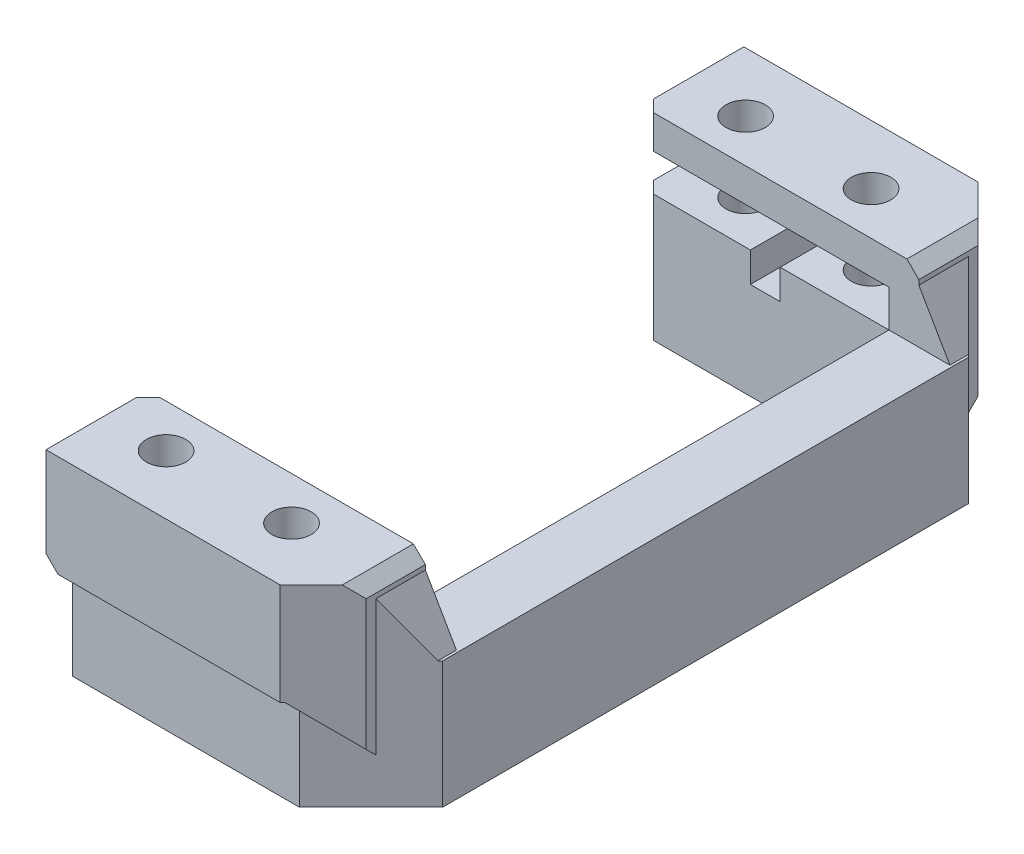
from build123d import *
from OCP.BRepFilletAPI import BRepFilletAPI_MakeChamfer

# Parameters (mm, degrees)
SKETCH_1_W          = 26
SKETCH_1_H          = 56
EXTRUDE_1_DEPTH     = 10.61
SKETCH_2_R          = 1.65
SKETCH_2_W          = 20.7
SKETCH_2_H          = 41.3
CUT_EXTRUDE_1_DEPTH = 33.643101875
SKETCH_3_W          = 2.5
SKETCH_3_H          = 56
CUT_EXTRUDE_2_DEPTH = 2.5
SKETCH_4_W          = 23.2
SKETCH_4_H          = 2.8
SKETCH_4_W_2        = 2.5
SKETCH_4_H_2        = 3.1
EXTRUDE_2_DEPTH     = 7.35
SKETCH_5_W          = 23.2
SKETCH_5_H          = 8.527384077
EXTRUDE_5_DEPTH     = 1.2
SKETCH_6_R          = 1.65
CUT_EXTRUDE_3_DEPTH = 36.975270673
CHAMFER_1_SIZE      = 4.5
CHAMFER_1_SIZE2     = 2.598076211
CHAMFER_2_SIZE      = 1
CHAMFER_3_SIZE      = 6
CHAMFER_6_SIZE      = 3.6


with BuildPart() as part:
    # 草图1 → 凸台-拉伸1 (new body)
    with BuildSketch(Plane(origin=(0, 0, 0), x_dir=(1, 0, 0), z_dir=(0, 1, 0))):
        Rectangle(SKETCH_1_W, SKETCH_1_H)
    extrude(amount=EXTRUDE_1_DEPTH)

    # 草图2 → 切除-拉伸1 (cut, through all)
    with BuildSketch(Plane(origin=(0, 10.61, 0), x_dir=(1, 0, 0), z_dir=(0, 1, 0))):
        with Locations(Location((-7.9, 24.25, 0), (0, 0, 270))):
            Circle(SKETCH_2_R)
        with Locations(Location((2.6, 24.25, 0), (0, 0, 90))):
            Circle(SKETCH_2_R)
        with Locations(Location((2.6, -24.25, 0), (0, 0, 270))):
            Circle(SKETCH_2_R)
        with Locations(Location((-7.9, -24.25, 0), (0, 0, 90))):
            Circle(SKETCH_2_R)
        with Locations((-2.65, 0)):
            Rectangle(SKETCH_2_W, SKETCH_2_H)
    extrude(amount=-CUT_EXTRUDE_1_DEPTH, mode=Mode.SUBTRACT)

    # 草图3 → 切除-拉伸2 (cut)
    with BuildSketch(Plane(origin=(0, 10.61, 0), x_dir=(1, 0, 0), z_dir=(0, 1, 0))):
        with Locations((-2.65, 0)):
            Rectangle(SKETCH_3_W, SKETCH_3_H)
    extrude(amount=-CUT_EXTRUDE_2_DEPTH, mode=Mode.SUBTRACT)

    # 草图4 → 凸台-拉伸2 (add)
    with BuildSketch(Plane.XY.offset(-20.65)):
        with Locations((-1.4, 15.11)):
            Rectangle(SKETCH_4_W, SKETCH_4_H)
        with Locations((8.95, 12.16)):
            Rectangle(SKETCH_4_W_2, SKETCH_4_H_2)
    extrude_2 = extrude(amount=-EXTRUDE_2_DEPTH)

    # 草图5 → 凸台-拉伸5 (add)
    with BuildSketch(Plane(origin=(0, 0, -28), x_dir=(-1, 0, 0), z_dir=(0, 0, -1))):
        with Locations((1.4, 12.246307962)):
            Rectangle(SKETCH_5_W, SKETCH_5_H)
    extrude_5 = extrude(amount=EXTRUDE_5_DEPTH)

    # 草图6 → 切除-拉伸3 (cut, through all)
    with BuildSketch(Plane(origin=(0, 16.51, 0), x_dir=(1, 0, 0), z_dir=(0, 1, 0))):
        with Locations(Location((2.6, 24.25, 0), (0, 0, 90))):
            Circle(SKETCH_6_R)
        with Locations(Location((-7.9, 24.25, 0), (0, 0, 270))):
            Circle(SKETCH_6_R)
    cut_extrude_3 = extrude(amount=-CUT_EXTRUDE_3_DEPTH, mode=Mode.SUBTRACT)

    # 镜向2: 凸台-拉伸2, 凸台-拉伸5, 切除-拉伸3 across plane
    add(extrude_2.mirror(Plane.XY))
    add(extrude_5.mirror(Plane.XY))
    add(cut_extrude_3.mirror(Plane.XY), mode=Mode.SUBTRACT)

    # 倒角1: one chamfer whose edges measure the first distance from different faces: ONE call of the kernel's chamfer builder (chamfer() names one face for all edges)
    chamfer_1_edges_1 = [part.edges().sort_by_distance(p)[0] for p in [
        (10.2, 10.61, 24.325),
    ]]
    chamfer_1_side_1 = [part.faces().sort_by_distance(p)[0] for p in [
        (10.2, 13.309190963, 25.141179594),
    ]]
    chamfer_1_edges_2 = [part.edges().sort_by_distance(p)[0] for p in [
        (10.2, 10.61, -24.325),
    ]]
    chamfer_1_side_2 = [part.faces().sort_by_distance(p)[0] for p in [
        (10.2, 13.309190963, -25.141179594),
    ]]
    chamfer_1 = BRepFilletAPI_MakeChamfer(part.part.solid().wrapped)
    for e in chamfer_1_edges_1:
        chamfer_1.Add(CHAMFER_1_SIZE, CHAMFER_1_SIZE2, e.wrapped, chamfer_1_side_1[0].wrapped)  # the first distance lies on this face
    for e in chamfer_1_edges_2:
        chamfer_1.Add(CHAMFER_1_SIZE, CHAMFER_1_SIZE2, e.wrapped, chamfer_1_side_2[0].wrapped)  # the first distance lies on this face
    add(Compound.cast(chamfer_1.Shape()), mode=Mode.REPLACE)

    # 倒角2
    chamfer_2_edges = [part.edges().sort_by_distance(p)[0] for p in [
        (-13, 3.991307961, -28),
        (-1.4, 7.982615923, -28),
        (-13, 7.982615923, -28.6),
        (10.2, 16.51, 24.925),
        (-13, 15.11, 20.65),
        (-13, 3.991307961, 28),
        (-1.4, 7.982615923, 28),
        (-13, 7.982615923, 28.6),
        (-13, 5.305, 20.65),
        (-13, 5.305, -20.65),
        (10.2, 16.51, -24.925),
        (-13, 15.11, -20.65),
    ]]
    chamfer(chamfer_2_edges, length=CHAMFER_2_SIZE)

    # 倒角3
    chamfer_3_edges = [part.edges().sort_by_distance(p)[0] for p in [
        (13, 5.305, 28),
        (13, 5.305, -28),
    ]]
    chamfer(chamfer_3_edges, length=CHAMFER_3_SIZE)

    # 倒角6
    chamfer_6_edges = [part.edges().sort_by_distance(p)[0] for p in [
        (10.2, 11.746307961, 29.2),
        (10.2, 11.746307961, -29.2),
    ]]
    chamfer(chamfer_6_edges, length=CHAMFER_6_SIZE)


solid = part.part
